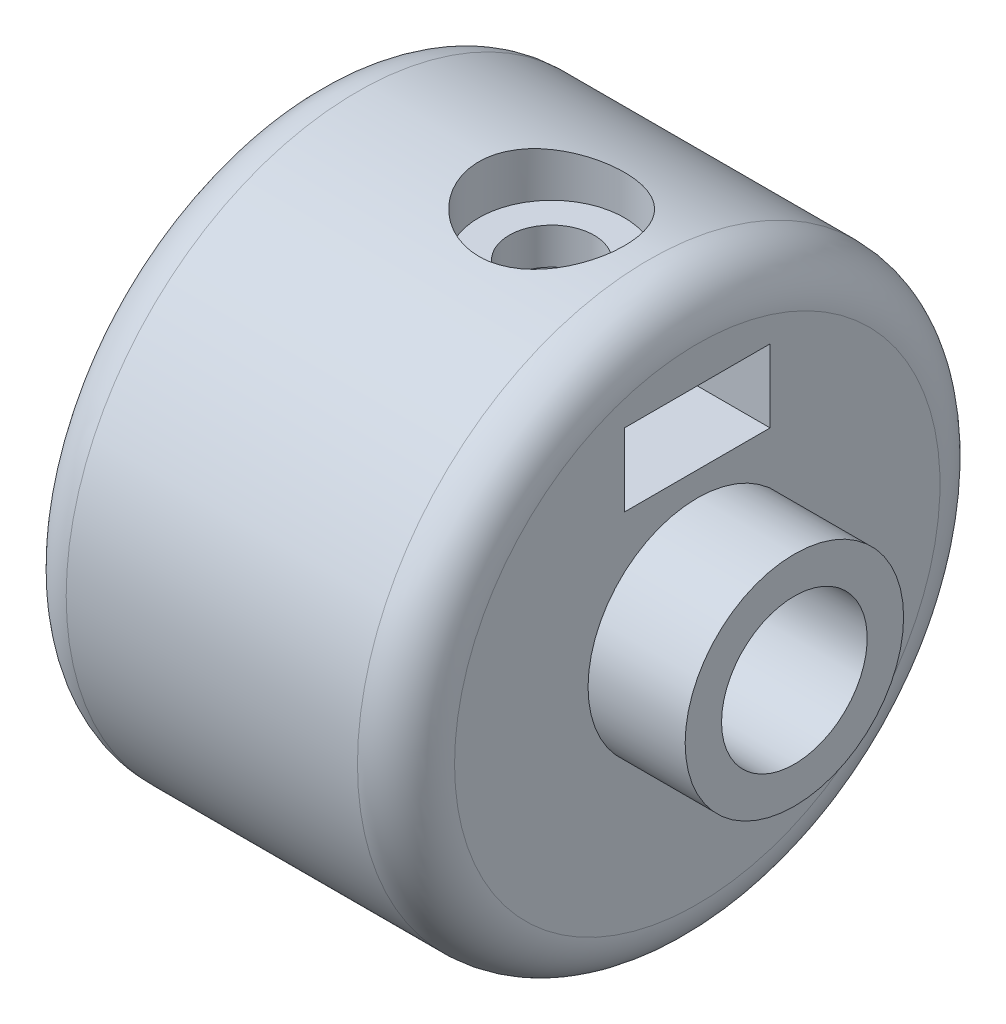
from build123d import *

# Parameters (mm, degrees)
SKETCH_2_R          = 1.75
CUT_EXTRUDE_5_DEPTH = 27.229754097
CUT_EXTRUDE_START   = 12
SKETCH_2_4_R        = 3
CUT_EXTRUDE_6_DEPTH = 2
SKETCH_4_W          = 6
SKETCH_4_H          = 3
CUT_EXTRUDE_7_DEPTH = 15
FILLET_1_R          = 2


with BuildPart() as part:
    # 草图1 → 旋转1 (revolve)
    with BuildSketch(Plane.XY):
        Polygon((-15, 3), (0, 3), (0, 4.5), (-4, 4.5), (-4, 12), (-20, 12), (-20, 0), (-15, 0), align=None)
    revolve(axis=Axis((-12.015902685, 0, 0), (1, 0, 0)))

    # 草图2 → 切除-拉伸5 (cut, through all)
    with BuildSketch(Plane(origin=(0, 0, 0), x_dir=(1, 0, 0), z_dir=(0, 1, 0))):
        with Locations((-10, 0)):
            Circle(SKETCH_2_R)
    extrude(amount=CUT_EXTRUDE_5_DEPTH, mode=Mode.SUBTRACT)

    # 草图2<4> → 切除-拉伸6 (cut)
    with BuildSketch(Plane(origin=(0, 0, 0), x_dir=(1, 0, 0), z_dir=(0, 1, 0)).offset(CUT_EXTRUDE_START)):
        with Locations((-10, 0)):
            Circle(SKETCH_2_4_R)
    extrude(amount=-CUT_EXTRUDE_6_DEPTH, mode=Mode.SUBTRACT)

    # 草图4 → 切除-拉伸7 (cut)
    with BuildSketch(Plane(origin=(0, 0, 0), x_dir=(0, 0, -1), z_dir=(1, 0, 0))):
        with Locations((0, 7)):
            Rectangle(SKETCH_4_W, SKETCH_4_H)
    extrude(amount=-CUT_EXTRUDE_7_DEPTH, mode=Mode.SUBTRACT)

    # 圆角1
    fillet_1_edges = [part.edges().sort_by_distance(p)[0] for p in [
        (-20, -12, 0),
        (-4, -12, 0),
    ]]
    fillet(fillet_1_edges, radius=FILLET_1_R)


solid = part.part
